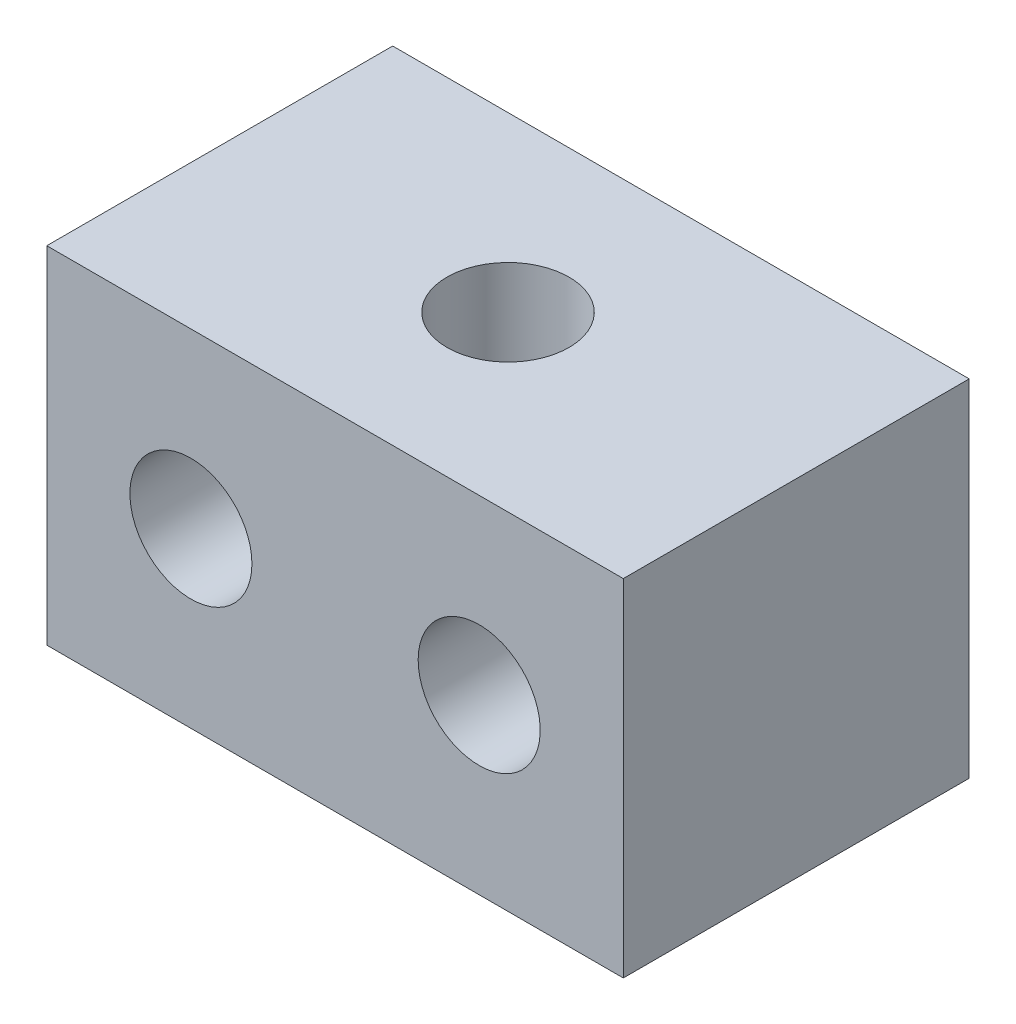
from build123d import *

# Parameters (mm, degrees)
SKETCH1_W           = 15
SKETCH1_H           = 9
BOSS_EXTRUDE1_DEPTH = 9
SKETCH2_R           = 1.5875
CUT_EXTRUDE1_DEPTH  = 13.549900398
SKETCH3_R           = 1.5875
CUT_EXTRUDE2_DEPTH  = 15.773286703


with BuildPart() as part:
    # Sketch1 → Boss-Extrude1 (new body)
    with BuildSketch(Plane(origin=(0, 0, 0), x_dir=(1, 0, 0), z_dir=(0, 1, 0))):
        Rectangle(SKETCH1_W, SKETCH1_H)
    extrude(amount=BOSS_EXTRUDE1_DEPTH)

    # Sketch2 → Cut-Extrude1 (cut, through all)
    with BuildSketch(Plane(origin=(0, 9, 0), x_dir=(1, 0, 0), z_dir=(0, 1, 0))):
        with Locations(Location((0, 0, 0), (0, 0, 270))):
            Circle(SKETCH2_R)
    extrude(amount=-CUT_EXTRUDE1_DEPTH, mode=Mode.SUBTRACT)

    # Sketch3 → Cut-Extrude2 (cut, through all)
    with BuildSketch(Plane.XY.offset(4.5)):
        with Locations((-3.75, 4.5)):
            Circle(SKETCH3_R)
        with Locations(Location((3.75, 4.5, 0), (0, 0, 180))):
            Circle(SKETCH3_R)
    extrude(amount=-CUT_EXTRUDE2_DEPTH, mode=Mode.SUBTRACT)


solid = part.part
